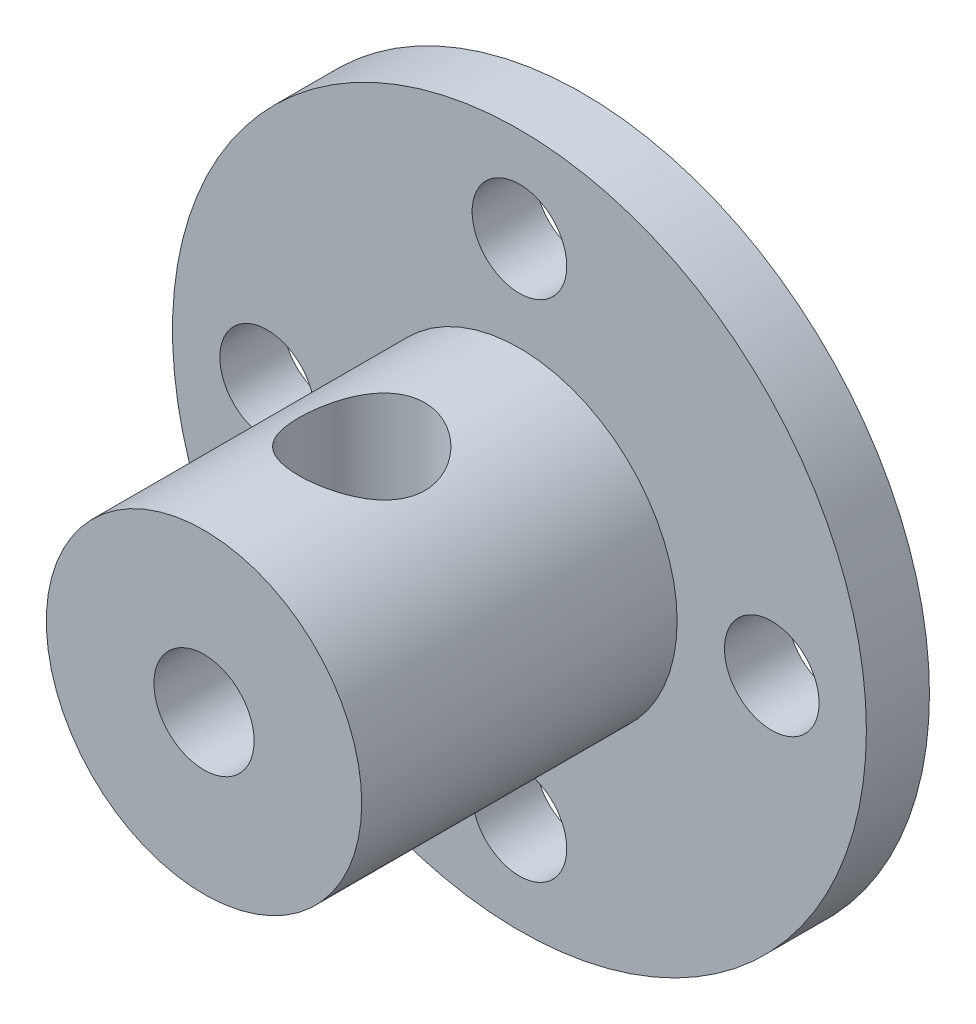
from build123d import *

# Parameters (mm, degrees)
SKETCH1_R               = 11
BOSS_EXTRUDE1_DEPTH     = 2
SKETCH2_R               = 5
SKETCH2_R_2             = 1.5875
BOSS_EXTRUDE2_DEPTH     = 10
SKETCH3_R               = 1.5
CUT_EXTRUDE1_DEPTH      = 19.493242009
CUT_EXTRUDE2_DEPTH      = 20.646882704
CUT_EXTRUDE2_DEPTH_BACK = 20.646882704
SKETCH4_R               = 2


with BuildPart() as part:
    # Sketch1 → Boss-Extrude1 (new body)
    with BuildSketch(Plane.XY):
        Circle(SKETCH1_R)
    extrude(amount=BOSS_EXTRUDE1_DEPTH)

    # Sketch2 → Boss-Extrude2 (add)
    with BuildSketch(Plane.XY.offset(2)):
        Circle(SKETCH2_R)
        Circle(SKETCH2_R_2, mode=Mode.SUBTRACT)
    extrude(amount=BOSS_EXTRUDE2_DEPTH)

    # Sketch3 → Cut-Extrude1 (cut, through all)
    with BuildSketch(Plane.XY.offset(2)):
        with Locations((0, 8)):
            Circle(SKETCH3_R)
        with Locations((8, 0)):
            Circle(SKETCH3_R)
        with Locations((0, -8)):
            Circle(SKETCH3_R)
        with Locations((-8, 0)):
            Circle(SKETCH3_R)
    extrude(amount=-CUT_EXTRUDE1_DEPTH, mode=Mode.SUBTRACT)

    # Sketch4 → Cut-Extrude2 (cut, two sides: drawn at the far end of the back side and taken through both)
    with BuildSketch(Plane(origin=(0, 0, 0), x_dir=(1, 0, 0), z_dir=(0, 1, 0)).offset(-CUT_EXTRUDE2_DEPTH_BACK)):
        with Locations(Location((0, -7, 0), (0, 0, 270))):
            Circle(SKETCH4_R)
    extrude(amount=CUT_EXTRUDE2_DEPTH + CUT_EXTRUDE2_DEPTH_BACK, mode=Mode.SUBTRACT)


solid = part.part
